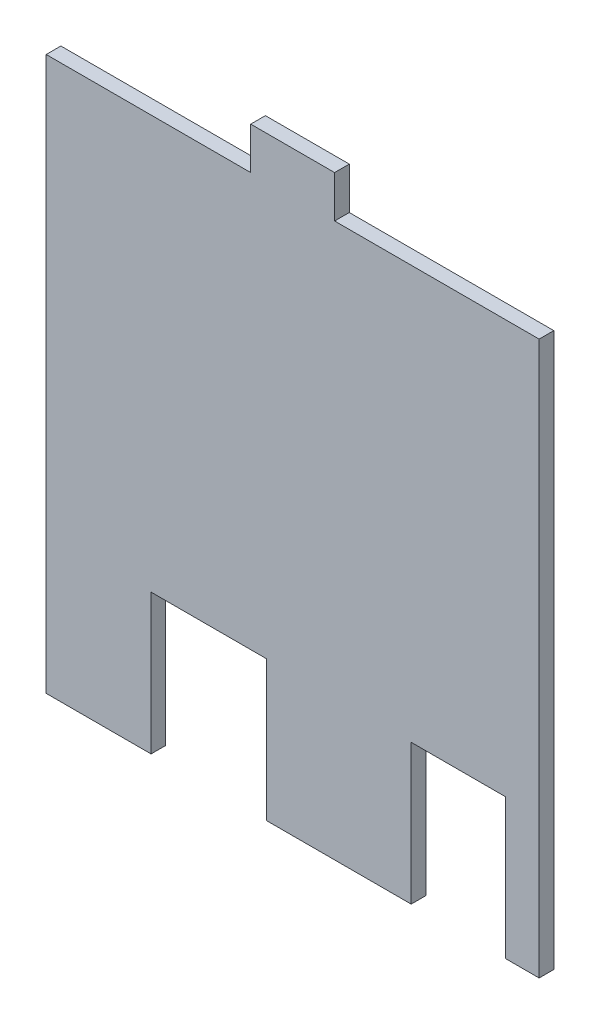
from build123d import *

# Parameters (mm, degrees)
BOSS_EXTRUDE1_DEPTH = 1.778


with BuildPart() as part:
    # Sketch1 → Boss-Extrude1 (new body)
    with BuildSketch(Plane.XY):
        Polygon((5.08, 33.5), (29.845, 33.5), (29.845, -33.5), (25.781, -33.5), (25.781, -16.529999904), (14.351, -16.529999904), (14.351, -33.5), (-3.175, -33.5), (-3.175, -16.529999904), (-17.145, -16.529999904), (-17.145, -33.5), (-29.845, -33.5), (-29.845, 33.5), (-5.08, 33.5), (-5.08, 38.58), (5.08, 38.58), align=None)
    extrude(amount=BOSS_EXTRUDE1_DEPTH)


solid = part.part
